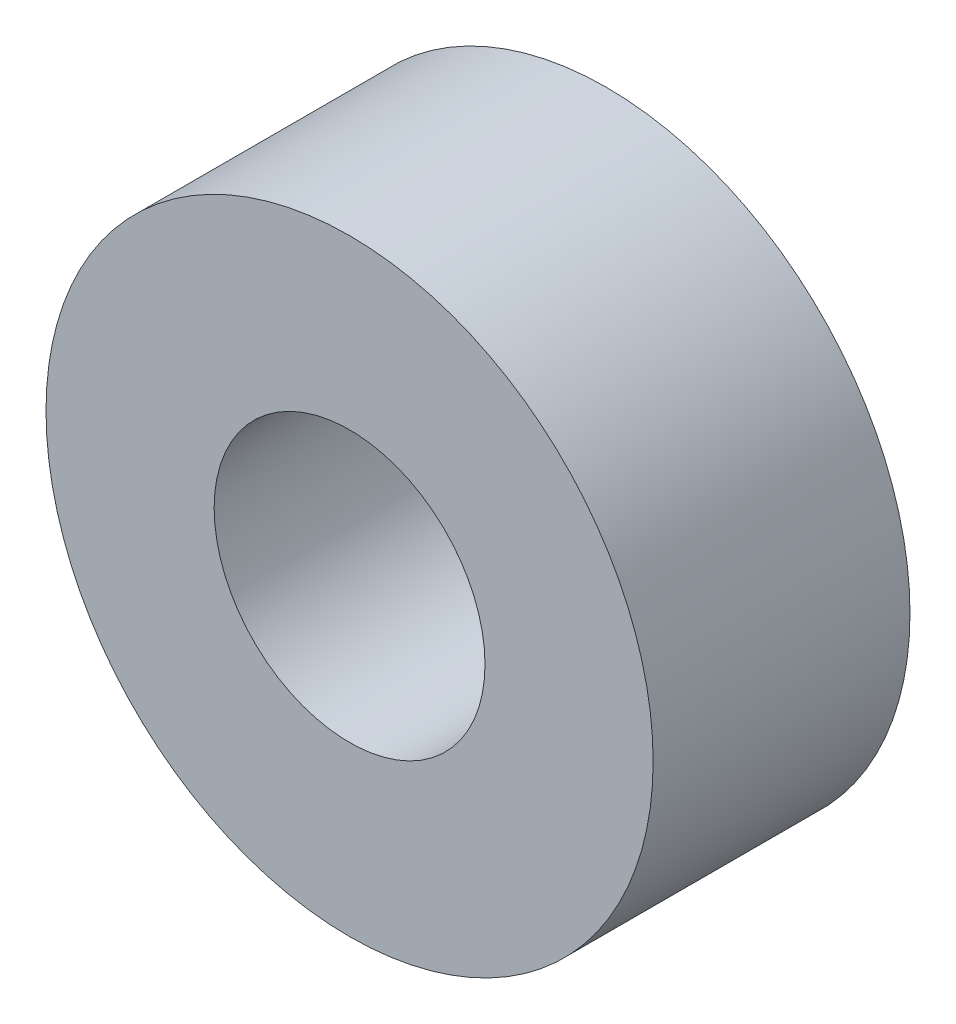
from build123d import *

# Parameters (mm, degrees)
SKETCH1_R           = 6.5
SKETCH1_R_2         = 2.9
BOSS_EXTRUDE1_DEPTH = 5.5


with BuildPart() as part:
    # Sketch1 → Boss-Extrude1 (new body)
    with BuildSketch(Plane.XY):
        Circle(SKETCH1_R)
        Circle(SKETCH1_R_2, mode=Mode.SUBTRACT)
    extrude(amount=BOSS_EXTRUDE1_DEPTH)


solid = part.part
